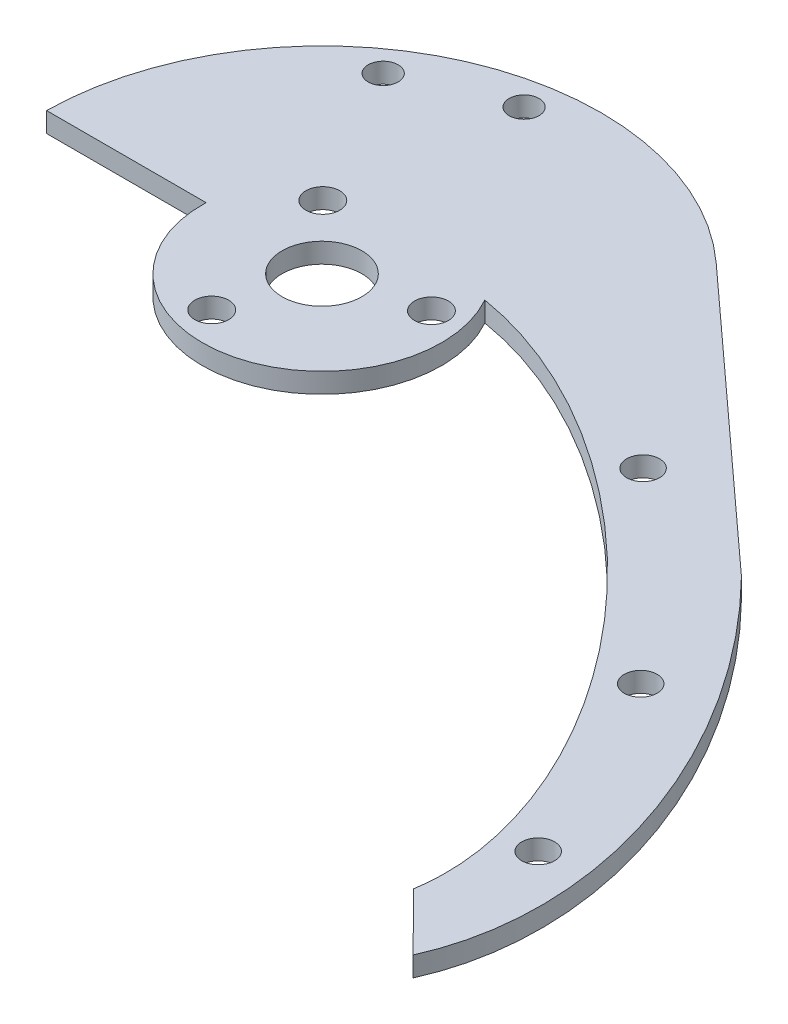
from build123d import *

# Parameters (mm, degrees)
SKETCH_1_R          = 1.7
SKETCH_1_R_2        = 4
EXTRUDE_1_DEPTH     = 2
SKETCH_2_R          = 1.5
SKETCH_2_R_2        = 1.65
CUT_EXTRUDE_2_DEPTH = 86.626937008


with BuildPart() as part:
    # Эскиз1 → Бобышка-Вытянуть1 (new body)
    with BuildSketch(Plane(origin=(0, 0, 0), x_dir=(1, 0, 0), z_dir=(0, 1, 0))):
        with BuildLine():
            Line((-11.994516295, 0.362737998), (-27.997650279, 0.362737998))
            ThreePointArc((-27.997650279, 0.362737998), (-19.670324553, 19.926824433), (0, 28))
            ThreePointArc((0, 28), (10.111304648, 26.110563347), (18.857990039, 20.697251308))
            Line((18.857990039, 20.697251308), (47.343097909, -5.256527408))
            add(Edge.make_bspline(
                [(63.764396425, -54.631632015), (73.929390971, -32.189504173), (47.343097909, -5.256527408)],
                knots=[3.37709689, 3.37709689, 3.37709689, 4.71238898, 4.71238898, 4.71238898], degree=2, weights=[1, 0.785281266, 1]))
            Line((63.764396425, -54.631632015), (58.046409316, -48.83908269))
            add(Edge.make_bspline(
                [(58.046409316, -48.83908269), (65.599461261, -3.0612118), (10.459692489, 5.881737247)],
                knots=[0.348473456, 0.348473456, 0.348473456, 2.541551794, 2.541551794, 2.541551794], degree=2, weights=[1, 0.456677717, 1]))
            ThreePointArc((10.459692489, 5.881737247), (2.864220523, -11.653164411), (-11.994516295, 0.362737998))
        make_face()
        with Locations(Location((-6.322604321, 6.40505071, 0), (0, 0, 270))):
            Circle(SKETCH_1_R, mode=Mode.SUBTRACT)
        with Locations(Location((0, 0, 0), (0, 0, 270))):
            Circle(SKETCH_1_R_2, mode=Mode.SUBTRACT)
        with Locations(Location((8.708238788, 2.273010605, 0), (0, 0, 270))):
            Circle(SKETCH_1_R, mode=Mode.SUBTRACT)
        with Locations(Location((-2.385634467, -8.678061315, 0), (0, 0, 270))):
            Circle(SKETCH_1_R, mode=Mode.SUBTRACT)
    extrude(amount=EXTRUDE_1_DEPTH)

    # Эскиз2 → Вырез-Вытянуть2 (cut, through all)
    with BuildSketch(Plane(origin=(0, 2, 0), x_dir=(1, 0, 0), z_dir=(0, 1, 0))):
        with Locations(Location((-4.341204442, 24.620193825, 0), (0, 0, 270))):
            Circle(SKETCH_2_R)
        with Locations(Location((-14.339410909, 20.478801107, 0), (0, 0, 90))):
            Circle(SKETCH_2_R)
        with Locations(Location((51.61994824, -19.642751406, 0), (0, 0, 270))):
            Circle(SKETCH_2_R_2)
        with Locations(Location((61.034534355, -39.343644659, 0), (0, 0, 270))):
            Circle(SKETCH_2_R_2)
        with Locations(Location((33.013487472, -0.79366348, 0), (0, 0, 270))):
            Circle(SKETCH_2_R_2)
    extrude(amount=-CUT_EXTRUDE_2_DEPTH, mode=Mode.SUBTRACT)


solid = part.part
